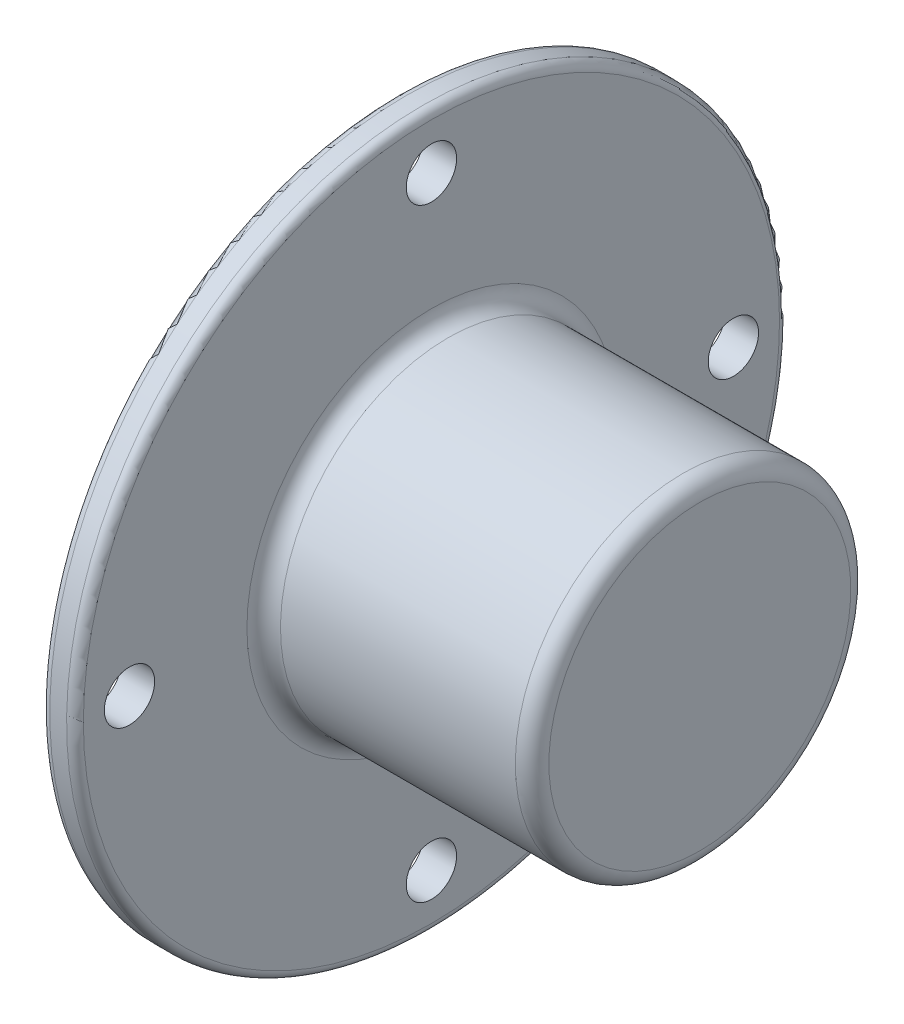
from build123d import *

# Parameters (mm, degrees)
CUT_EXTRUDE1_REACH = 36.046
SKETCH3_R          = 1.5
CIRPATTERN1_COUNT  = 4
FILLET1_R          = 0.5
FILLET2_R          = 1


with BuildPart() as part:
    # Sketch2 → Revolve1 (revolve)
    with BuildSketch(Plane.XY):
        Polygon((0, 0), (0, 21.25), (2, 21.25), (2, 10), (18, 10), (18, 0), align=None)
    revolve(axis=Axis((18, 0, 0), (-1, 0, 0)))

    # Sketch3 → Cut-Extrude1 (cut, up to next)
    with BuildSketch(Plane(origin=(2, 0, 0), x_dir=(0, 0, -1), z_dir=(1, 0, 0)), mode=Mode.PRIVATE) as cut_extrude1_sk1:
        with Locations(Location((0, 18, 0), (0, 0, 90))):
            Circle(SKETCH3_R)
    cut_extrude1_tool1 = extrude(cut_extrude1_sk1.sketch, amount=-CUT_EXTRUDE1_REACH, mode=Mode.PRIVATE) & part.part
    cut_extrude1 = cut_extrude1_tool1.solids().sort_by_distance((2, 18, 0))[0]
    add(cut_extrude1, mode=Mode.SUBTRACT)

    # CirPattern1: Cut-Extrude1 ×4 about axis
    cirpattern1_axis = Axis((0, 0, 0), (1, 0, 0))
    for i in range(1, CIRPATTERN1_COUNT):
        add(cut_extrude1.rotate(cirpattern1_axis, i * 360 / CIRPATTERN1_COUNT), mode=Mode.SUBTRACT)

    # Fillet1
    fillet1_edges = [part.edges().sort_by_distance(p)[0] for p in [
        (2, -21.25, 0),
        (0, -21.25, 0),
    ]]
    fillet(fillet1_edges, radius=FILLET1_R)

    # Fillet2
    fillet2_edges = [part.edges().sort_by_distance(p)[0] for p in [
        (18, -10, 0),
        (2, -10, 0),
    ]]
    fillet(fillet2_edges, radius=FILLET2_R)


solid = part.part
